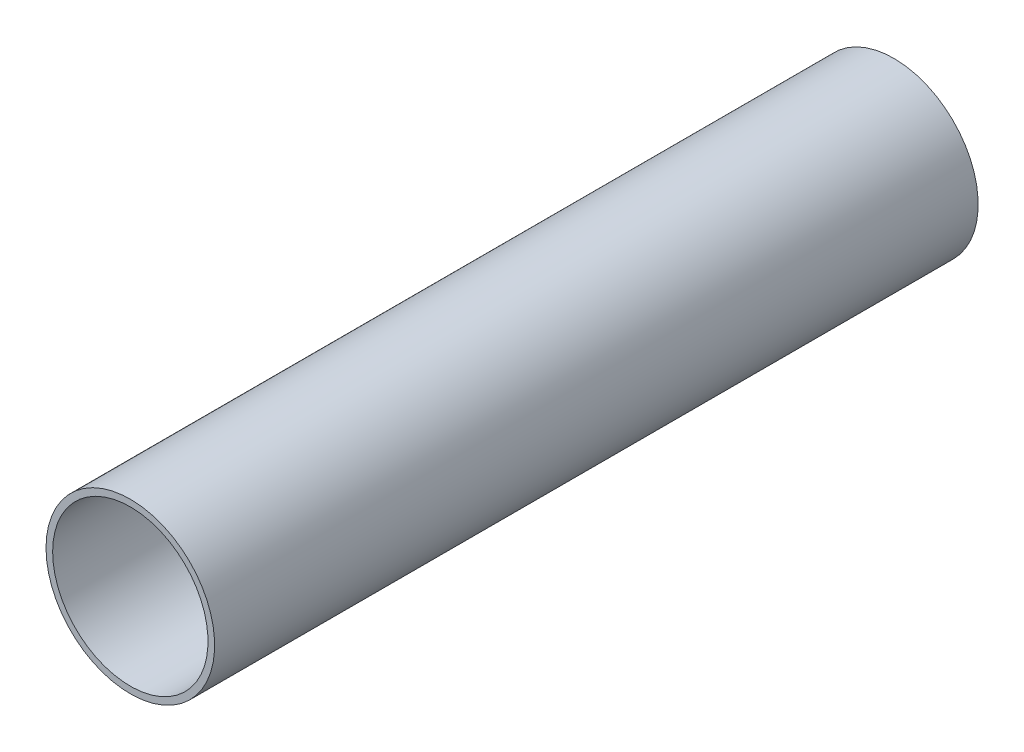
from build123d import *

# Parameters (mm, degrees)
SWEEP_THIN_PROFILE_R   = 12.7
SWEEP_THIN_PROFILE_R_2 = 11.7


with BuildPart() as part:
    # Sweep-Thin: sweep along a path in Path
    with BuildLine(Plane(origin=(0, 0, 0), x_dir=(0, 0, -1), z_dir=(1, 0, 0))) as sweep_thin_path:
        Line((0, 0), (115, 0))
    # Sweep-Thin profile (on start of the path) → Sweep-Thin (sweep)
    with BuildSketch(Plane(origin=(0, 0, 0), x_dir=(-1, 0, 0), z_dir=(0, 0, -1))):
        Circle(SWEEP_THIN_PROFILE_R)
        Circle(SWEEP_THIN_PROFILE_R_2, mode=Mode.SUBTRACT)
    sweep(path=sweep_thin_path.line)


solid = part.part
